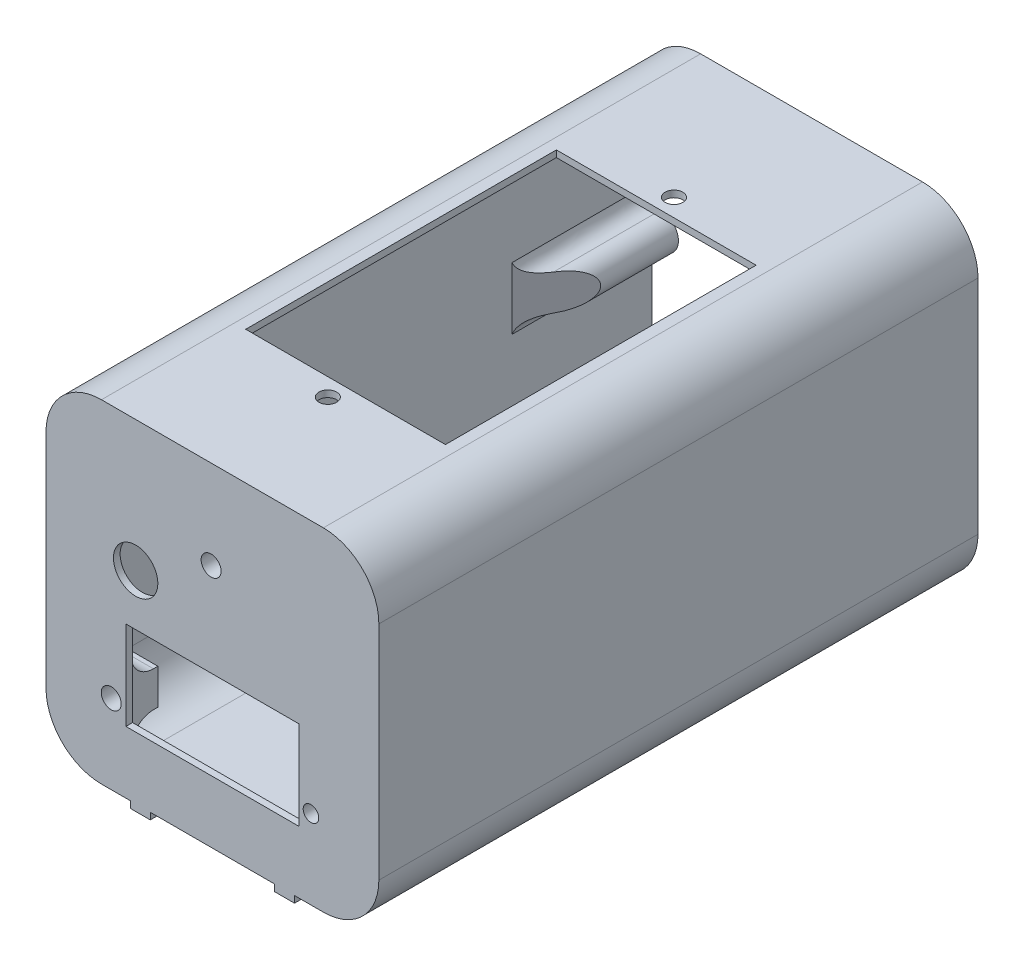
from build123d import *

# Parameters (mm, degrees)
SKETCH1_R           = 5
SKETCH1_W           = 39
SKETCH1_H           = 20
BOSS_EXTRUDE1_DEPTH = 1.5
BOSS_EXTRUDE3_START = 133.5
BOSS_EXTRUDE3_DEPTH = 133.5
BOSS_EXTRUDE4_DEPTH = 30
CUT_EXTRUDE1_DEPTH  = 15
CUT_EXTRUDE2_DEPTH  = 15
SKETCH7_R           = 2
CUT_EXTRUDE3_DEPTH  = 15
SKETCH10_W          = 45
SKETCH10_H          = 70
CUT_EXTRUDE4_DEPTH  = 1.5
SKETCH11_R          = 2
CUT_EXTRUDE6_DEPTH  = 1.5
SKETCH15_W          = 7
SKETCH15_H          = 7
SKETCH15_W_2        = 5.9
SKETCH15_H_2        = 8
BOSS_EXTRUDE5_DEPTH = 6
SKETCH16_R          = 2.25
SKETCH16_R_2        = 1.75
CUT_EXTRUDE20_DEPTH = 10
FILLET5_R           = 5
FILLET6_R           = 5
FILLET7_R           = 5
SKETCH17_W          = 4.5
SKETCH17_H          = 1.5
BOSS_EXTRUDE6_DEPTH = 135


with BuildPart() as part:
    # Sketch1 → Boss-Extrude1 (new body)
    with BuildSketch(Plane.XY):
        with BuildLine():
            Line((50.3, -11.5), (0.3, -11.5))
            ThreePointArc((0.3, -11.5), (-8.538834765, -7.838834765), (-12.2, 1))
            Line((-12.2, 1), (-12.2, 51))
            ThreePointArc((-12.2, 51), (-8.538834765, 59.838834765), (0.3, 63.5))
            Line((0.3, 63.5), (50.3, 63.5))
            ThreePointArc((50.3, 63.5), (59.138834765, 59.838834765), (62.8, 51))
            Line((62.8, 51), (62.8, 1))
            ThreePointArc((62.8, 1), (59.138834765, -7.838834765), (50.3, -11.5))
        make_face()
        with Locations((8, 34)):
            Circle(SKETCH1_R, mode=Mode.SUBTRACT)
        with Locations((25.3, 12.5)):
            Rectangle(SKETCH1_W, SKETCH1_H, mode=Mode.SUBTRACT)
    extrude(amount=BOSS_EXTRUDE1_DEPTH)

    # Sketch3 → Boss-Extrude3 (add)
    with BuildSketch(Plane(origin=(0, 0, 0), x_dir=(-1, 0, 0), z_dir=(0, 0, -1)).offset(BOSS_EXTRUDE3_START)):
        with BuildLine():
            Line((-50.3, 63.5), (-0.3, 63.5))
            ThreePointArc((-0.3, 63.5), (8.538834765, 59.838834765), (12.2, 51))
            Line((12.2, 51), (12.2, 1))
            ThreePointArc((12.2, 1), (8.538834765, -7.838834765), (-0.3, -11.5))
            Line((-0.3, -11.5), (-50.3, -11.5))
            ThreePointArc((-50.3, -11.5), (-59.138834765, -7.838834765), (-62.8, 1))
            Line((-62.8, 1), (-62.8, 51))
            ThreePointArc((-62.8, 51), (-59.138834765, 59.838834765), (-50.3, 63.5))
        make_face()
        with BuildLine():
            Line((10.7, 1), (10.7, 51))
            ThreePointArc((10.7, 51), (7.478174593, 58.778174593), (-0.3, 62))
            Line((-0.3, 62), (-50.3, 62))
            ThreePointArc((-50.3, 62), (-58.078174593, 58.778174593), (-61.3, 51))
            Line((-61.3, 51), (-61.3, 1))
            ThreePointArc((-61.3, 1), (-58.078174593, -6.778174593), (-50.3, -10))
            Line((-50.3, -10), (-0.3, -10))
            ThreePointArc((-0.3, -10), (7.478174593, -6.778174593), (10.7, 1))
        make_face(mode=Mode.SUBTRACT)
    extrude(amount=-BOSS_EXTRUDE3_DEPTH)

    # Sketch4 → Boss-Extrude4 (add)
    with BuildSketch(Plane(origin=(0, 0, -132), x_dir=(-1, 0, 0), z_dir=(0, 0, -1))):
        with BuildLine():
            Line((-61.3, 33), (-61.3, 19))
            add(Edge.make_bspline(
                [(-57.8, 22), (-60.735988769, 21.788932059), (-61.3, 19)],
                knots=[0, 0, 0, 1, 1, 1], degree=2))
            ThreePointArc((-57.8, 22), (-53.8, 26), (-57.8, 30))
            add(Edge.make_bspline(
                [(-57.8, 30), (-60.735988769, 30.211067941), (-61.3, 33)],
                knots=[0, 0, 0, 1, 1, 1], degree=2))
        make_face()
        with BuildLine():
            Line((10.7, 33), (10.7, 19))
            add(Edge.make_bspline(
                [(7.2, 22), (10.135988769, 21.788932059), (10.7, 19)],
                knots=[0, 0, 0, 1, 1, 1], degree=2))
            ThreePointArc((7.2, 22), (3.2, 26), (7.2, 30))
            add(Edge.make_bspline(
                [(7.2, 30), (10.135988769, 30.211067941), (10.7, 33)],
                knots=[0, 0, 0, 1, 1, 1], degree=2))
        make_face()
    extrude(amount=-BOSS_EXTRUDE4_DEPTH)

    # Sketch5 → Cut-Extrude1 (cut)
    with BuildSketch(Plane(origin=(0, 33, 0), x_dir=(-1, 0, 0), z_dir=(0, -1, 0))):
        Polygon((10.7, 102), (3.2, 102), (3.2, 114.5), align=None)
    extrude(amount=CUT_EXTRUDE1_DEPTH, mode=Mode.SUBTRACT)

    # Sketch6 → Cut-Extrude2 (cut)
    with BuildSketch(Plane(origin=(0, 33, 0), x_dir=(-1, 0, 0), z_dir=(0, -1, 0))):
        Polygon((-61.3, 102), (-53.8, 102), (-53.8, 114.5), align=None)
    extrude(amount=CUT_EXTRUDE2_DEPTH, mode=Mode.SUBTRACT)

    # Sketch7 → Cut-Extrude3 (cut)
    with BuildSketch(Plane(origin=(0, 0, -132), x_dir=(-1, 0, 0), z_dir=(0, 0, -1))):
        with Locations((-57.8, 26)):
            Circle(SKETCH7_R)
        with Locations((7.2, 26)):
            Circle(SKETCH7_R)
    extrude(amount=-CUT_EXTRUDE3_DEPTH, mode=Mode.SUBTRACT)

    # Sketch10 → Cut-Extrude4 (cut)
    with BuildSketch(Plane(origin=(0, 63.5, 0), x_dir=(1, 0, 0), z_dir=(0, 1, 0))):
        with Locations((25.3, 63.5)):
            Rectangle(SKETCH10_W, SKETCH10_H)
    extrude(amount=-CUT_EXTRUDE4_DEPTH, mode=Mode.SUBTRACT)

    # Sketch11 → Cut-Extrude6 (cut)
    with BuildSketch(Plane(origin=(0, 63.5, 0), x_dir=(1, 0, 0), z_dir=(0, 1, 0))):
        with Locations(Location((25.3, 102.5, 0), (0, 0, 270))):
            Circle(SKETCH11_R)
        with Locations(Location((25.3, 24.5, 0), (0, 0, 270))):
            Circle(SKETCH11_R)
    extrude(amount=-CUT_EXTRUDE6_DEPTH, mode=Mode.SUBTRACT)

    # Sketch15 → Boss-Extrude5 (add)
    with BuildSketch(Plane.XY):
        with Locations((24.5, 44)):
            Rectangle(SKETCH15_W, SKETCH15_H)
        with Locations((48.55, 6.35)):
            Rectangle(SKETCH15_W_2, SKETCH15_H_2)
        with Locations((2, 6.35)):
            Rectangle(SKETCH15_W, SKETCH15_H_2)
    extrude(amount=-BOSS_EXTRUDE5_DEPTH)

    # Sketch16 → Cut-Extrude20 (cut)
    with BuildSketch(Plane.XY.offset(1.5)):
        with Locations((25, 43.5)):
            Circle(SKETCH16_R)
        with Locations((47.5, 6.35)):
            Circle(SKETCH16_R_2)
        with Locations((2.5, 6.35)):
            Circle(SKETCH16_R)
    extrude(amount=-CUT_EXTRUDE20_DEPTH, mode=Mode.SUBTRACT)

    # Fillet5
    fillet5_edges = [part.edges().sort_by_distance(p)[0] for p in [
        (-1.5, 6.35, 0),
        (2, 2.35, 0),
        (2, 10.35, 0),
    ]]
    fillet(fillet5_edges, radius=FILLET5_R)

    # Fillet6
    fillet6_edges = [part.edges().sort_by_distance(p)[0] for p in [
        (51.5, 6.35, 0),
        (48.55, 10.35, 0),
        (48.55, 2.35, 0),
    ]]
    fillet(fillet6_edges, radius=FILLET6_R)

    # Fillet7
    fillet7_edges = [part.edges().sort_by_distance(p)[0] for p in [
        (21, 44, 0),
        (24.5, 40.5, 0),
        (28, 44, 0),
        (24.5, 47.5, 0),
    ]]
    fillet(fillet7_edges, radius=FILLET7_R)

    # Sketch17 → Boss-Extrude6 (add)
    with BuildSketch(Plane.XY.offset(1.5)):
        with Locations((41.55, -12.25)):
            Rectangle(SKETCH17_W, SKETCH17_H)
        with Locations((9.05, -12.25)):
            Rectangle(SKETCH17_W, SKETCH17_H)
    extrude(amount=-BOSS_EXTRUDE6_DEPTH)


solid = part.part
